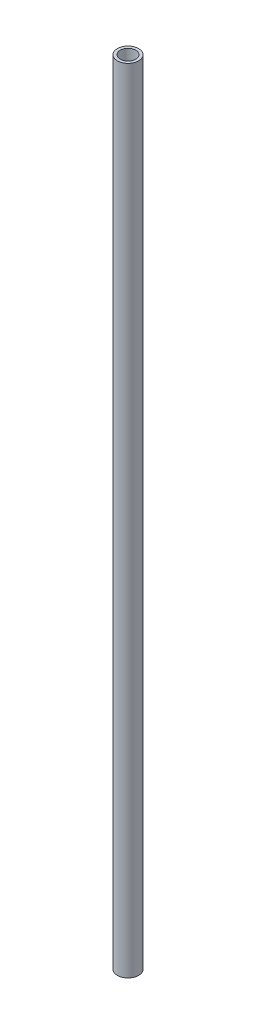
from build123d import *

# Parameters (mm, degrees)
SKETCH1_R           = 13
SKETCH1_R_2         = 9.525
BOSS_EXTRUDE1_DEPTH = 967.74


with BuildPart() as part:
    # Sketch1 → Boss-Extrude1 (new body)
    with BuildSketch(Plane(origin=(0, 0, 0), x_dir=(1, 0, 0), z_dir=(0, 1, 0))):
        with Locations(Location((0, 0, 0), (0, 0, 270))):
            Circle(SKETCH1_R)
        with Locations(Location((0, 0, 0), (0, 0, 270))):
            Circle(SKETCH1_R_2, mode=Mode.SUBTRACT)
    extrude(amount=BOSS_EXTRUDE1_DEPTH)


solid = part.part
